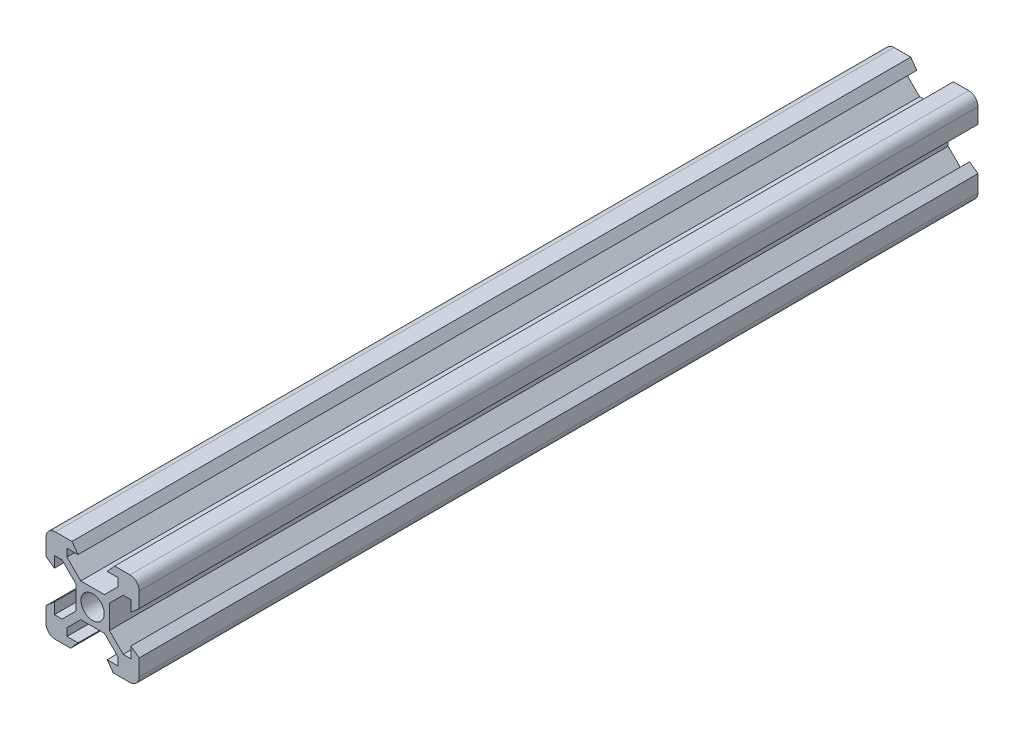
from build123d import *

# Parameters (mm, degrees)
SKETCH1_R           = 2.5
BOSS_EXTRUDE1_DEPTH = 180


with BuildPart() as part:
    # Sketch1 → Boss-Extrude1 (new body)
    with BuildSketch(Plane.XY):
        with BuildLine():
            Line((-4.725542729, -10), (-3.125, -8.2))
            Line((-3.125, -8.2), (-5.5, -8.2))
            Line((-5.5, -8.2), (-5.5, -6.560660172))
            Line((-5.5, -6.560660172), (-2.539339828, -3.6))
            Line((-2.539339828, -3.6), (2.539339828, -3.6))
            Line((2.539339828, -3.6), (5.5, -6.560660172))
            Line((5.5, -6.560660172), (5.5, -8.2))
            Line((5.5, -8.2), (3.125, -8.2))
            Line((3.125, -8.2), (4.434457271, -10))
            Line((4.434457271, -10), (8, -10))
            ThreePointArc((8, -10), (9.414213562, -9.414213562), (10, -8))
            Line((10, -8), (10, -4.434457271))
            Line((10, -4.434457271), (8.2, -3.125))
            Line((8.2, -3.125), (8.2, -5.5))
            Line((8.2, -5.5), (6.560660172, -5.5))
            Line((6.560660172, -5.5), (3.6, -2.539339828))
            Line((3.6, -2.539339828), (3.6, 2.539339828))
            Line((3.6, 2.539339828), (6.560660172, 5.5))
            Line((6.560660172, 5.5), (8.2, 5.5))
            Line((8.2, 5.5), (8.2, 3.125))
            Line((8.2, 3.125), (10, 4.725542729))
            Line((10, 4.725542729), (10, 8))
            ThreePointArc((10, 8), (9.414213562, 9.414213562), (8, 10))
            Line((8, 10), (4.725542729, 10))
            Line((4.725542729, 10), (3.125, 8.2))
            Line((3.125, 8.2), (5.5, 8.2))
            Line((5.5, 8.2), (5.5, 6.560660172))
            Line((5.5, 6.560660172), (2.539339828, 3.6))
            Line((2.539339828, 3.6), (-2.539339828, 3.6))
            Line((-2.539339828, 3.6), (-5.5, 6.560660172))
            Line((-5.5, 6.560660172), (-5.5, 8.2))
            Line((-5.5, 8.2), (-3.125, 8.2))
            Line((-3.125, 8.2), (-4.434457271, 10))
            Line((-4.434457271, 10), (-8, 10))
            ThreePointArc((-8, 10), (-9.414213562, 9.414213562), (-10, 8))
            Line((-10, 8), (-10, 4.434457271))
            Line((-10, 4.434457271), (-8.2, 3.125))
            Line((-8.2, 3.125), (-8.2, 5.5))
            Line((-8.2, 5.5), (-6.560660172, 5.5))
            Line((-6.560660172, 5.5), (-3.6, 2.539339828))
            Line((-3.6, 2.539339828), (-3.6, -2.539339828))
            Line((-3.6, -2.539339828), (-6.560660172, -5.5))
            Line((-6.560660172, -5.5), (-8.2, -5.5))
            Line((-8.2, -5.5), (-8.2, -3.125))
            Line((-8.2, -3.125), (-10, -4.725542729))
            Line((-10, -4.725542729), (-10, -8))
            ThreePointArc((-10, -8), (-9.414213562, -9.414213562), (-8, -10))
            Line((-8, -10), (-4.725542729, -10))
        make_face()
        with Locations(Location((0, 0, 0), (0, 0, 180))):
            Circle(SKETCH1_R, mode=Mode.SUBTRACT)
    extrude(amount=BOSS_EXTRUDE1_DEPTH)


solid = part.part
